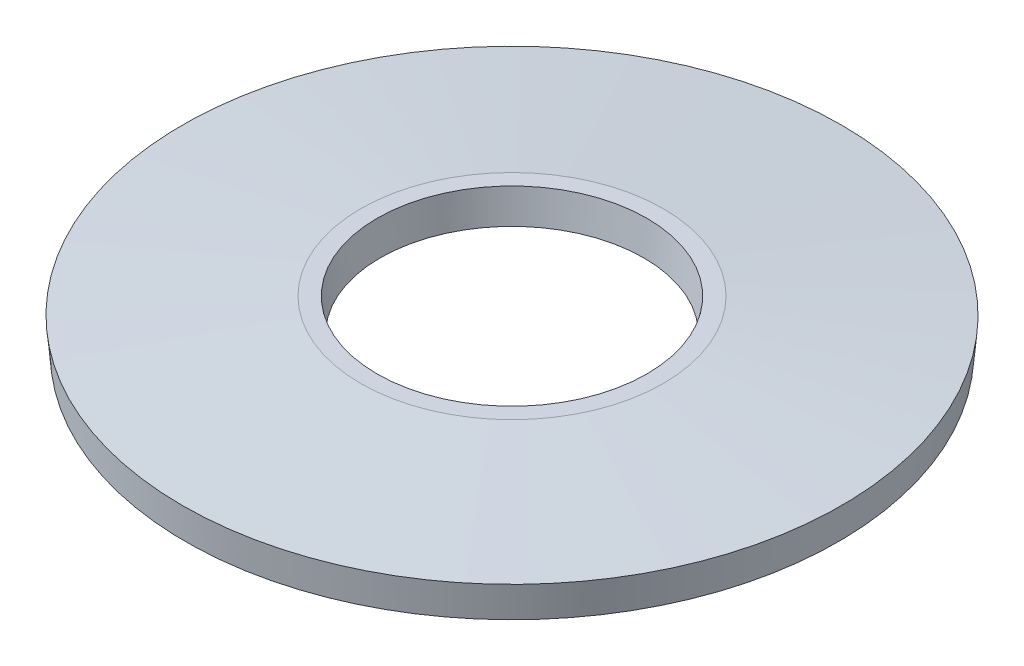
from build123d import *


with BuildPart() as part:
    # Sketch1 → Revolve1 (revolve)
    with BuildSketch(Plane.XY, mode=Mode.PRIVATE) as revolve1_sk:
        Polygon((-3.762853364, 0), (-1.6, 0.201728576), (-1.637146636, 0.6), (-1.837146636, 0.6), (-4, 0.398271424), (-3.962853364, 0), align=None)
    revolve(revolve1_sk.sketch.rotate(Axis((0, 0, 0), (0, 1, 0)), 270), axis=Axis((0, 0, 0), (0, 1, 0)))


solid = part.part
